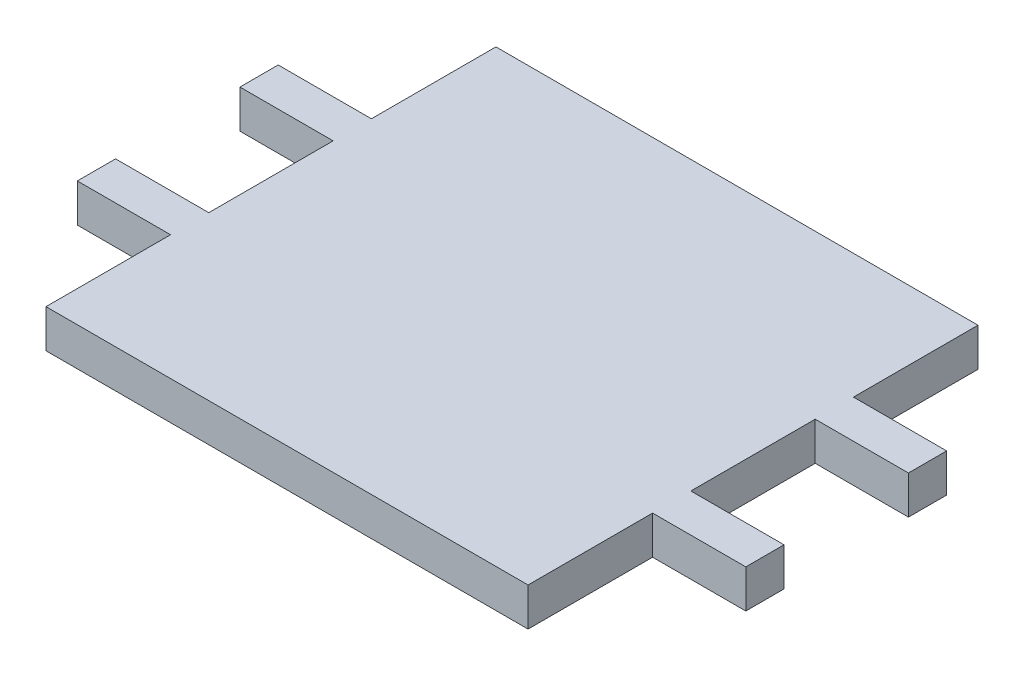
from build123d import *

# Parameters (mm, degrees)
SKETCH1_W           = 76.2
SKETCH1_H           = 71.12
SKETCH1_W_2         = 14.732
SKETCH1_H_2         = 6.0452
BOSS_EXTRUDE1_DEPTH = 6.0452


with BuildPart() as part:
    # Sketch1 → Boss-Extrude1 (new body)
    with BuildSketch(Plane(origin=(0, 0, 0), x_dir=(1, 0, 0), z_dir=(0, 1, 0))):
        Rectangle(SKETCH1_W, SKETCH1_H)
        with Locations((-45.466, -12.8524)):
            Rectangle(SKETCH1_W_2, SKETCH1_H_2)
        with Locations((-45.466, 12.8524)):
            Rectangle(SKETCH1_W_2, SKETCH1_H_2)
        with Locations((45.466, 12.8524)):
            Rectangle(SKETCH1_W_2, SKETCH1_H_2)
        with Locations((45.466, -12.8524)):
            Rectangle(SKETCH1_W_2, SKETCH1_H_2)
    extrude(amount=BOSS_EXTRUDE1_DEPTH)


solid = part.part
